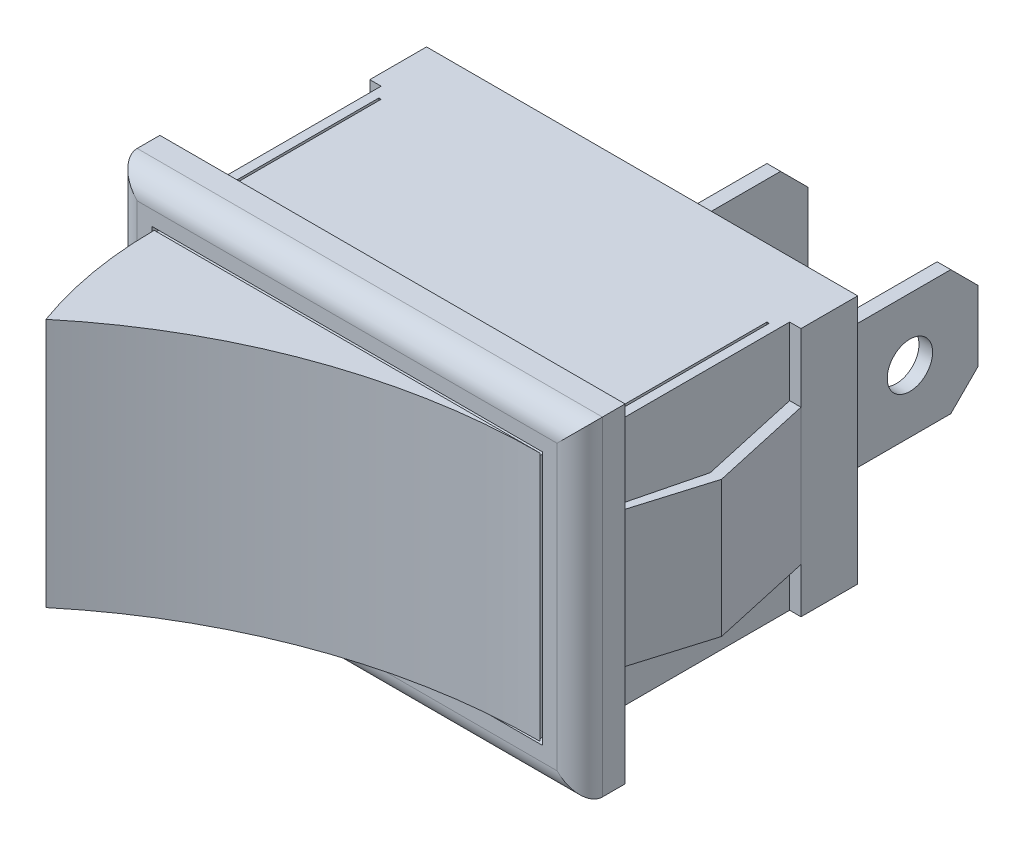
from build123d import *

# Parameters (mm, degrees)
SKETCH_1_W          = 20.5
SKETCH_1_H          = 14.5
EXTRUDE_1_DEPTH     = 2
FILLET_1_R          = 1
SKETCH_2_W          = 18
SKETCH_2_H          = 11
EXTRUDE_2_DEPTH     = 11
SKETCH_3_W          = 2.5
SKETCH_3_H          = 11
EXTRUDE_3_DEPTH     = 0.5
SKETCH_4_W          = 2.5
SKETCH_4_H          = 11
EXTRUDE_4_DEPTH     = 0.5
SKETCH_5_R          = 0.3
CUT_EXTRUDE_1_DEPTH = 27.529464751
SKETCH_6_W          = 0.6
SKETCH_6_H          = 4
EXTRUDE_5_DEPTH     = 0.5
SKETCH_7_W          = 0.818024616
SKETCH_7_H          = 6
SKETCH_7_W_2        = 0.8
CUT_EXTRUDE_2_DEPTH = 4
SKETCH_8_W          = 0.6
SKETCH_8_H          = 5.5
EXTRUDE_6_DEPTH     = 11
CHAMFER_1_SIZE      = 1.2
SKETCH_9_R          = 1
CUT_EXTRUDE_3_DEPTH = 30.326651701
EXTRUDE_7_DEPTH     = 6
EXTRUDE_8_DEPTH     = 11
SKETCH_12_W         = 17.2
SKETCH_12_H         = 11.2
SKETCH_12_W_2       = 17
SKETCH_12_H_2       = 11
CUT_EXTRUDE_4_DEPTH = 10
SKETCH_13_W         = 17
SKETCH_13_H         = 0.1
CUT_EXTRUDE_5_DEPTH = 1


with BuildPart() as part:
    # 草图1 → 凸台-拉伸1 (new body)
    with BuildSketch(Plane.XY):
        with Locations((10.25, 7.25)):
            Rectangle(SKETCH_1_W, SKETCH_1_H)
    extrude(amount=EXTRUDE_1_DEPTH)

    # 圆角1
    fillet_1_edges = [part.edges().sort_by_distance(p)[0] for p in [
        (20.5, 7.25, 2),
        (10.25, 14.5, 2),
        (0, 7.25, 2),
        (10.25, 0, 2),
    ]]
    fillet(fillet_1_edges, radius=FILLET_1_R)

    # 草图2 → 凸台-拉伸2 (add)
    with BuildSketch(Plane(origin=(0, 0, 0), x_dir=(-1, 0, 0), z_dir=(0, 0, -1))):
        with Locations((-10.25, 7.25)):
            Rectangle(SKETCH_2_W, SKETCH_2_H)
    extrude(amount=EXTRUDE_2_DEPTH)

    # 草图3 → 凸台-拉伸3 (add)
    with BuildSketch(Plane(origin=(19.25, 0, 0), x_dir=(0, 0, -1), z_dir=(1, 0, 0))):
        with Locations((9.75, 7.25)):
            Rectangle(SKETCH_3_W, SKETCH_3_H)
    extrude(amount=EXTRUDE_3_DEPTH)

    # 草图4 → 凸台-拉伸4 (add)
    with BuildSketch(Plane.ZY.offset(-1.25)):
        with Locations((-9.75, 7.25)):
            Rectangle(SKETCH_4_W, SKETCH_4_H)
    extrude(amount=EXTRUDE_4_DEPTH)

    # 草图5 → 切除-拉伸1 (cut, through all)
    with BuildSketch(Plane(origin=(0, 12.75, 0), x_dir=(1, 0, 0), z_dir=(0, 1, 0))):
        with Locations(Location((10.25, 0.5, 0), (0, 0, 180))):
            Circle(SKETCH_5_R)
    extrude(amount=-CUT_EXTRUDE_1_DEPTH, mode=Mode.SUBTRACT)

    # 草图6 → 凸台-拉伸5 (add)
    with BuildSketch(Plane(origin=(0, 0, -11), x_dir=(-1, 0, 0), z_dir=(0, 0, -1))):
        with Locations((-18.45, 7.25)):
            Rectangle(SKETCH_6_W, SKETCH_6_H)
        with Locations((-17.05, 7.25)):
            Rectangle(SKETCH_6_W, SKETCH_6_H)
        with Locations((-10.95, 7.25)):
            Rectangle(SKETCH_6_W, SKETCH_6_H)
        with Locations((-9.55, 7.25)):
            Rectangle(SKETCH_6_W, SKETCH_6_H)
        with Locations((-3.45, 7.25)):
            Rectangle(SKETCH_6_W, SKETCH_6_H)
        with Locations((-2.05, 7.25)):
            Rectangle(SKETCH_6_W, SKETCH_6_H)
    extrude(amount=EXTRUDE_5_DEPTH)

    # 草图7 → 切除-拉伸2 (cut)
    with BuildSketch(Plane(origin=(0, 0, -11), x_dir=(-1, 0, 0), z_dir=(0, 0, -1))):
        with Locations((-17.740987692, 7.25)):
            Rectangle(SKETCH_7_W, SKETCH_7_H)
        with Locations((-10.25, 7.25)):
            Rectangle(SKETCH_7_W_2, SKETCH_7_H)
        with Locations((-2.75, 7.25)):
            Rectangle(SKETCH_7_W_2, SKETCH_7_H)
    extrude(amount=-CUT_EXTRUDE_2_DEPTH, mode=Mode.SUBTRACT)

    # 草图8 → 凸台-拉伸6 (add)
    with BuildSketch(Plane(origin=(0, 0, -7), x_dir=(-1, 0, 0), z_dir=(0, 0, -1))):
        with Locations((-17.75, 7.25)):
            Rectangle(SKETCH_8_W, SKETCH_8_H)
        with Locations((-10.25, 7.25)):
            Rectangle(SKETCH_8_W, SKETCH_8_H)
    extrude(amount=EXTRUDE_6_DEPTH)

    # 倒角1
    chamfer_1_edges = [part.edges().sort_by_distance(p)[0] for p in [
        (17.75, 4.5, -18),
        (17.75, 10, -18),
        (10.25, 4.5, -18),
        (10.25, 10, -18),
    ]]
    chamfer(chamfer_1_edges, length=CHAMFER_1_SIZE)

    # 草图9 → 切除-拉伸3 (cut, through all)
    with BuildSketch(Plane(origin=(18.05, 0, 0), x_dir=(0, 0, -1), z_dir=(1, 0, 0))):
        with Locations((15, 7.25)):
            Circle(SKETCH_9_R)
    extrude(amount=-CUT_EXTRUDE_3_DEPTH, mode=Mode.SUBTRACT)

    # 草图10 → 凸台-拉伸7 (add)
    with BuildSketch(Plane(origin=(0, 3.75, 0), x_dir=(-1, 0, 0), z_dir=(0, -1, 0))):
        Polygon((-19.25, 0), (-19.55, 0), (-20.75, 4), (-19.75, 8.5), (-19.25, 8.5), (-20.25, 4), align=None)
        Polygon((-1.25, 0), (-0.95, 0), (0.25, 4), (-0.75, 8.5), (-1.25, 8.5), (-0.25, 4), align=None)
    extrude(amount=-EXTRUDE_7_DEPTH)

    # 草图11 → 凸台-拉伸8 (add)
    with BuildSketch(Plane.XZ.offset(-1.75)):
        with BuildLine():
            Line((18.75, 2), (1.75, 2))
            ThreePointArc((1.75, 2), (2.005105989, 4.934028723), (2.762767594, 7.78))
            ThreePointArc((2.762767594, 7.78), (10.25, 3.489364109), (18.75, 2))
        make_face()
    extrude(amount=-EXTRUDE_8_DEPTH)

    # 草图12 → 切除-拉伸4 (cut)
    with BuildSketch(Plane.XY.offset(2)):
        with Locations((10.25, 7.25)):
            Rectangle(SKETCH_12_W, SKETCH_12_H)
        with Locations((10.25, 7.25)):
            Rectangle(SKETCH_12_W_2, SKETCH_12_H_2, mode=Mode.SUBTRACT)
    extrude(amount=-CUT_EXTRUDE_4_DEPTH, mode=Mode.SUBTRACT)

    # 草图13 → 切除-拉伸5 (cut)
    with BuildSketch(Plane.XY.offset(2)):
        with Locations((10.25, 1.8)):
            Rectangle(SKETCH_13_W, SKETCH_13_H)
        with Locations((10.25, 12.7)):
            Rectangle(SKETCH_13_W, SKETCH_13_H)
    extrude(amount=-CUT_EXTRUDE_5_DEPTH, mode=Mode.SUBTRACT)


solid = part.part
